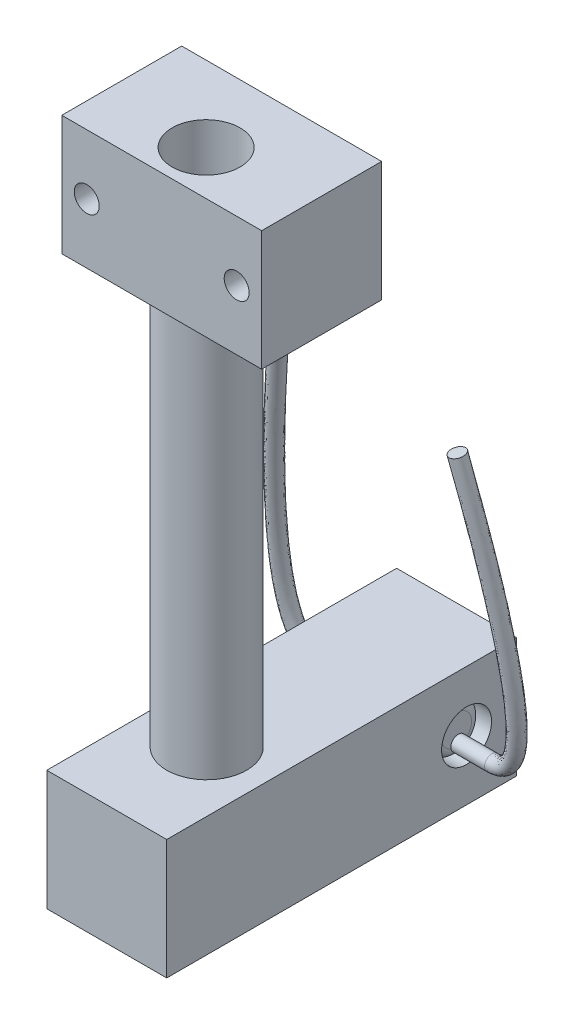
from build123d import *

# Parameters (mm, degrees)
SKIZZE1_W                       = 12
SKIZZE1_H                       = 12
AUFSATZ_LINEAR_AUSTRAGEN1_DEPTH = 35
SKIZZE2_R                       = 2.5
SCHNITT_LINEAR_AUSTRAGEN1_DEPTH = 35
M8_GEWINDEBOHRUNG1_D            = 6.8
FASE1_SIZE                      = 3
VERRUNDUNG2_R                   = 1
SKIZZE8_R                       = 4
SKIZZE8_R_2                     = 2.5
AUFSATZ_LINEAR_AUSTRAGEN2_DEPTH = 50
FASE2_SIZE                      = 1
SKIZZE9_R                       = 2.5
AUFSATZ_LINEAR_AUSTRAGEN3_DEPTH = 5
VERRUNDUNG3_R                   = 1
SKIZZE11_R                      = 0.75
SKIZZE12_W                      = 12
SKIZZE12_H                      = 12
AUFSATZ_LINEAR_AUSTRAGEN4_DEPTH = 10
SKIZZE15_W                      = 1.25
SKIZZE15_H                      = 17.5
M3_GEWINDEBOHRUNG1_AT_2_COUNT   = 2
M3_GEWINDEBOHRUNG1_AT_2_PITCH   = 15


with BuildPart() as part:
    # Skizze1 → Aufsatz-Linear austragen1 (new body)
    with BuildSketch(Plane.XY):
        Rectangle(SKIZZE1_W, SKIZZE1_H)
    extrude(amount=AUFSATZ_LINEAR_AUSTRAGEN1_DEPTH)

    # Skizze2 → Schnitt-Linear austragen1 (cut)
    with BuildSketch(Plane.ZY.offset(6)):
        with Locations((5, 0)):
            Circle(SKIZZE2_R)
    extrude(amount=-SCHNITT_LINEAR_AUSTRAGEN1_DEPTH, mode=Mode.SUBTRACT)

    # M8 Gewindebohrung1 (through all)
    with Locations(Plane(origin=(0, 6, 0), x_dir=(-1, 0, 0), z_dir=(0, 1, 0))):
        with Locations((0, 25)):
            Hole(M8_GEWINDEBOHRUNG1_D / 2)


with BuildPart() as body_2:
    # Skizze7 → Rotation1 (revolve)
    with BuildSketch(Plane(origin=(0, 0, 0), x_dir=(0, 0, -1), z_dir=(1, 0, 0))):
        Polygon((-29, 2), (-26.5, 2), (-26.5, -8.5), (-25.25, -8.5), (-25.25, -10), (-29, -10), align=None)
    revolve(axis=Axis((0, 2, 25), (0, -1, 0)))

    # Fase1
    fase1_edges = [body_2.edges().sort_by_distance(p)[0] for p in [
        (0, -10, 21),
    ]]
    chamfer(fase1_edges, length=FASE1_SIZE)

    # Verrundung2
    verrundung2_edges = [body_2.edges().sort_by_distance(p)[0] for p in [
        (0, -7, 21),
    ]]
    fillet(verrundung2_edges, radius=VERRUNDUNG2_R)


with BuildPart() as body_3:
    # Skizze8 → Aufsatz-Linear austragen2 (new body)
    with BuildSketch(Plane(origin=(0, 2, 0), x_dir=(1, 0, 0), z_dir=(0, 1, 0))):
        with Locations((0, -25)):
            Circle(SKIZZE8_R)
        with Locations((0, -25)):
            Circle(SKIZZE8_R_2, mode=Mode.SUBTRACT)
    extrude(amount=AUFSATZ_LINEAR_AUSTRAGEN2_DEPTH)

    # Fase2
    fase2_edges = [body_3.edges().sort_by_distance(p)[0] for p in [
        (-4, 2, 25),
        (-4, 52, 25),
    ]]
    chamfer(fase2_edges, length=FASE2_SIZE)


with BuildPart() as body_4:
    # Skizze9 → Aufsatz-Linear austragen3 (new, symmetric)
    with BuildSketch(Plane(origin=(0, 0, 0), x_dir=(0, 0, -1), z_dir=(1, 0, 0))):
        with Locations((-5, 0)):
            Circle(SKIZZE9_R)
    extrude(amount=AUFSATZ_LINEAR_AUSTRAGEN3_DEPTH, both=True)

    # Verrundung3
    verrundung3_edges = [body_4.edges().sort_by_distance(p)[0] for p in [
        (5, 0, 7.5),
        (-5, 0, 7.5),
    ]]
    fillet(verrundung3_edges, radius=VERRUNDUNG3_R)

    # Austragung1: sweep along a path in Skizze10
    with BuildLine() as austragung1_path:  # in the path sketch's own coordinates; laid on its plane below (add() does not lay a ready-made edge on the line's plane)
        add(Edge.make_bspline(
            [(9.0031118, 28.952922174), (14.661016366, -0.530624786), (8.3744964, -0.530624786)],
            knots=[0, 0, 0, 1, 1, 1], degree=2))
        Line((8.3744964, -0.530624786), (-8.3744964, -0.530624786))
        add(Edge.make_bspline(
            [(-8.3744964, -0.530624786), (-14.661016366, -0.530624786), (-9.0031118, 28.952922174)],
            knots=[0, 0, 0, 1, 1, 1], degree=2))
    # Skizze11 → Austragung1 (sweep)
    with BuildSketch(Plane(origin=(9.0031118, 27.982060936, 8.932622201), x_dir=(-0.980384779209946, -0.17813021392733064, -0.08435230630912684), z_dir=(-0.1884616539074955, 0.9725230087492234, 0.13667919541689408))):
        Circle(SKIZZE11_R)
    sweep(path=Plane(origin=(0, -0.68909339, 4.90315424), x_dir=(-1, 0, 0), z_dir=(0, 0.1391731009600624, -0.9902680687415708)) * austragung1_path.line)


with BuildPart() as body_5:
    # Skizze12 → Aufsatz-Linear austragen4 (new, symmetric)
    with BuildSketch(Plane(origin=(0, 0, 0), x_dir=(0, 0, -1), z_dir=(1, 0, 0))):
        with Locations((-23.5, 52)):
            Rectangle(SKIZZE12_W, SKIZZE12_H)
    extrude(amount=AUFSATZ_LINEAR_AUSTRAGEN4_DEPTH, both=True)

    # Skizze13 → M8 Gewindebohrung2 (revolve, cut)
    with BuildSketch(Plane(origin=(0.006122574, 58, 25.06694587), x_dir=(0, 0, 1), z_dir=(1, 0, 0))):
        Polygon((0, 0), (0, 24.292926105), (3.4, 22.25), (3.4, 0), align=None)
    revolve(axis=Axis((0.006122574, 64.35, 25.06694587), (0, -1, 0)), mode=Mode.SUBTRACT)

    # Skizze15 → M3 Gewindebohrung1 (revolve, cut)
    with BuildSketch(Plane(origin=(7.5, 52, 17.5), x_dir=(0, 1, 0), z_dir=(1, 0, 0))):
        with Locations((0.625, 8.75)):
            Rectangle(SKIZZE15_W, SKIZZE15_H)
    m3_gewindebohrung1 = revolve(axis=Axis((7.5, 52, 11.15), (0, 0, 1)), mode=Mode.SUBTRACT)

    # M3 Gewindebohrung1 at 2: M3 Gewindebohrung1 ×2
    with Locations(*[(-i * M3_GEWINDEBOHRUNG1_AT_2_PITCH, 0, 0) for i in range(1, M3_GEWINDEBOHRUNG1_AT_2_COUNT)]):
        add(m3_gewindebohrung1, mode=Mode.SUBTRACT)


solid = Compound([part.part, body_2.part, body_3.part, body_4.part, body_5.part])
